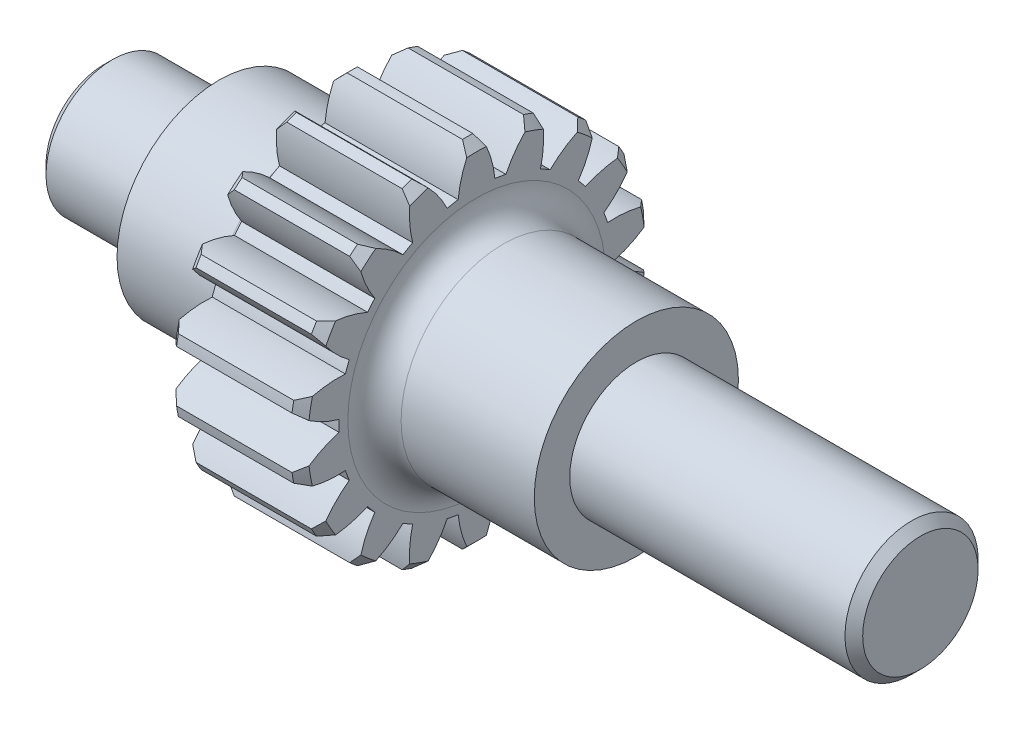
from build123d import *

# Parameters (mm, degrees)
BOSS_EXTRUDE1_DEPTH          = 15
CHAMFER1_SIZE                = 1
CIRPATTERN1_COUNT            = 18
CHAMFER1_OF_CIRPATTERN1_SIZE = 1
FILLET1_R                    = 3
CHAMFER2_SIZE                = 1


with BuildPart() as part:
    # Sketch1 → Revolve1 (revolve)
    with BuildSketch(Plane.XY, mode=Mode.PRIVATE) as revolve1_sk:
        Polygon((0, 0), (0, 7.5), (13, 7.5), (13, 11.5), (27, 11.5), (27, 15.5), (42, 15.5), (42, 11.5), (60, 11.5), (60, 7.5), (92, 7.5), (92, 0), align=None)
    revolve(revolve1_sk.sketch.rotate(Axis((0, 0, 0), (1, 0, 0)), 90), axis=Axis((0, 0, 0), (1, 0, 0)))

    # Sketch7 → Boss-Extrude1 (add)
    with BuildSketch(Plane(origin=(42, 0, 0), x_dir=(0, 0, -1), z_dir=(1, 0, 0))):
        with BuildLine():
            ThreePointArc((2.07, 15.361155555), (0, 15.5), (-2.07, 15.361155555))
            ThreePointArc((-2.07, 15.361155555), (-1.57, 17.755209018), (-0.58, 19.991588231))
            ThreePointArc((-0.58, 19.991588231), (0, 20), (0.58, 19.991588231))
            ThreePointArc((0.58, 19.991588231), (1.57, 17.755209018), (2.07, 15.361155555))
        make_face()
    boss_extrude1 = extrude(amount=-BOSS_EXTRUDE1_DEPTH)

    # Chamfer1
    chamfer1_edges = [part.edges().sort_by_distance(p)[0] for p in [
        (27, 20, 0),
        (42, 20, 0),
    ]]
    chamfer(chamfer1_edges, length=CHAMFER1_SIZE)

    # CirPattern1: Boss-Extrude1 ×18 about axis
    cirpattern1_axis = Axis((0, 0, 0), (1, 0, 0))
    for i in range(1, CIRPATTERN1_COUNT):
        add(boss_extrude1.rotate(cirpattern1_axis, i * 360 / CIRPATTERN1_COUNT))

    # Chamfer1 of CirPattern1
    chamfer1_of_cirpattern1_edges = [part.edges().sort_by_distance(p)[0] for p in [
        (27, 18.793852416, 6.840402867),
        (42, 18.793852416, 6.840402867),
        (27, 15.320888862, 12.855752194),
        (42, 15.320888862, 12.855752194),
        (27, 10, 17.320508076),
        (42, 10, 17.320508076),
        (27, 3.472963553, 19.69615506),
        (42, 3.472963553, 19.69615506),
        (27, -3.472963553, 19.69615506),
        (42, -3.472963553, 19.69615506),
        (27, -10, 17.320508076),
        (42, -10, 17.320508076),
        (27, -15.320888862, 12.855752194),
        (42, -15.320888862, 12.855752194),
        (27, -18.793852416, 6.840402867),
        (42, -18.793852416, 6.840402867),
        (27, -20, 0),
        (42, -20, 0),
        (27, -18.793852416, -6.840402867),
        (42, -18.793852416, -6.840402867),
        (27, -15.320888862, -12.855752194),
        (42, -15.320888862, -12.855752194),
        (27, -10, -17.320508076),
        (42, -10, -17.320508076),
        (27, -3.472963553, -19.69615506),
        (42, -3.472963553, -19.69615506),
        (27, 3.472963553, -19.69615506),
        (42, 3.472963553, -19.69615506),
        (27, 10, -17.320508076),
        (42, 10, -17.320508076),
        (27, 15.320888862, -12.855752194),
        (42, 15.320888862, -12.855752194),
        (27, 18.793852416, -6.840402867),
        (42, 18.793852416, -6.840402867),
    ]]
    chamfer(chamfer1_of_cirpattern1_edges, length=CHAMFER1_OF_CIRPATTERN1_SIZE)

    # Fillet1
    fillet1_edges = [part.edges().sort_by_distance(p)[0] for p in [
        (42, 0, -11.5),
        (27, 0, -11.5),
    ]]
    fillet(fillet1_edges, radius=FILLET1_R)

    # Chamfer2
    chamfer2_edges = [part.edges().sort_by_distance(p)[0] for p in [
        (0, 0, -7.5),
        (92, 0, -7.5),
    ]]
    chamfer(chamfer2_edges, length=CHAMFER2_SIZE)


solid = part.part
